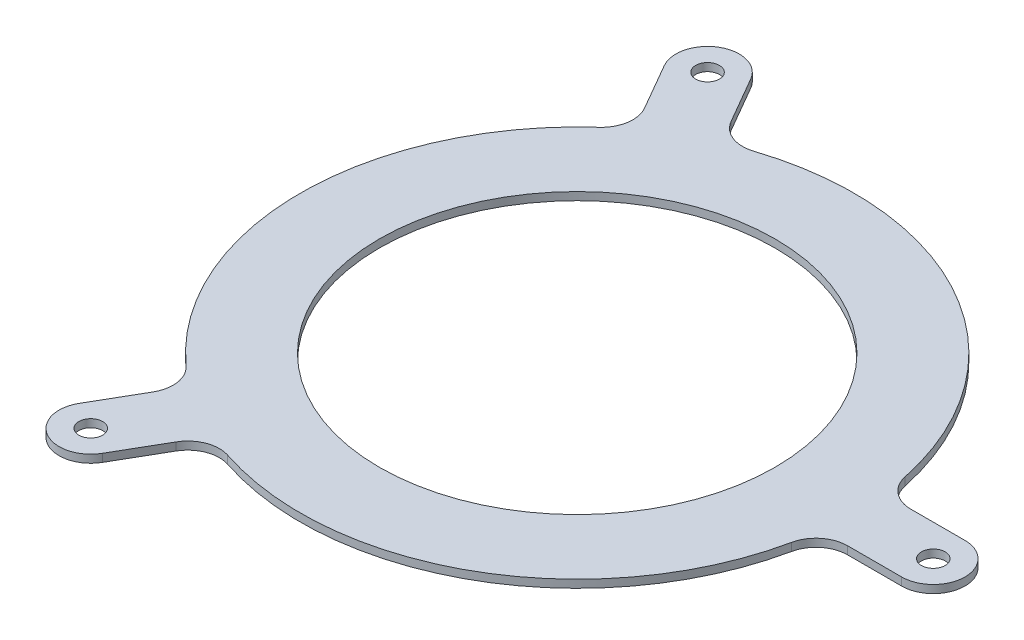
from build123d import *

# Parameters (mm, degrees)
SKETCH1_R           = 35
SKETCH1_R_2         = 25
SKETCH1_R_3         = 1.5
BOSS_EXTRUDE1_DEPTH = 1
FILLET1_R           = 4


with BuildPart() as part:
    # Sketch1 → Boss-Extrude1 (new body)
    # profile 1 of 4: a face of its own
    with BuildSketch(Plane(origin=(0, 0, 0), x_dir=(1, 0, 0), z_dir=(0, 1, 0))):
        Circle(SKETCH1_R)
        with Locations(Location((0, 0, 0), (0, 0, 270))):
            Circle(SKETCH1_R_2, mode=Mode.SUBTRACT)
    # profile 2 of 4: a face of its own
    with BuildSketch(Plane(origin=(0, 0, 0), x_dir=(1, 0, 0), z_dir=(0, 1, 0))):
        with BuildLine():
            ThreePointArc((-20.849440266, 28.11228985), (-17.5, 30.310889132), (-13.921237036, 32.11228985))
            Line((-13.921237036, 32.11228985), (-19.035586192, 40.970602437))
            Line((-19.035586192, 40.970602437), (-19.035898385, 40.97114317))
            ThreePointArc((-19.035898385, 40.97114317), (-24.5, 42.435244785), (-25.964101615, 36.97114317))
            Line((-25.964101615, 36.97114317), (-20.849440266, 28.11228985))
        make_face()
        with Locations(Location((-22.5, 38.97114317, 0), (0, 0, 270))):
            Circle(SKETCH1_R_3, mode=Mode.SUBTRACT)
    # profile 3 of 4: a face of its own
    with BuildSketch(Plane(origin=(0, 0, 0), x_dir=(1, 0, 0), z_dir=(0, 1, 0))):
        with BuildLine():
            Line((-19.035898385, -40.97114317), (-13.921237036, -32.11228985))
            ThreePointArc((-13.921237036, -32.11228985), (-17.5, -30.310889132), (-20.849440266, -28.11228985))
            Line((-20.849440266, -28.11228985), (-25.963789422, -36.970602437))
            Line((-25.963789422, -36.970602437), (-25.964101615, -36.97114317))
            ThreePointArc((-25.964101615, -36.97114317), (-24.5, -42.435244785), (-19.035898385, -40.97114317))
        make_face()
        with Locations(Location((-22.5, -38.97114317, 0), (0, 0, 270))):
            Circle(SKETCH1_R_3, mode=Mode.SUBTRACT)
    # profile 4 of 4: a face of its own
    with BuildSketch(Plane(origin=(0, 0, 0), x_dir=(1, 0, 0), z_dir=(0, 1, 0))):
        with BuildLine():
            ThreePointArc((45, -4), (49, 0), (45, 4))
            Line((45, 4), (34.770677301, 4))
            ThreePointArc((34.770677301, 4), (34.942622294, 2.00328411), (35, 0))
            ThreePointArc((35, 0), (34.942622294, -2.00328411), (34.770677301, -4))
            Line((34.770677301, -4), (44.999375615, -4))
            Line((44.999375615, -4), (45, -4))
        make_face()
        with Locations(Location((45, 0, 0), (0, 0, 270))):
            Circle(SKETCH1_R_3, mode=Mode.SUBTRACT)
    extrude(amount=BOSS_EXTRUDE1_DEPTH)

    # Fillet1
    fillet1_edges = [part.edges().sort_by_distance(p)[0] for p in [
        (-13.921237036, 0.5, 32.11228985),
        (-20.849440266, 0.5, 28.11228985),
        (-20.849440266, 0.5, -28.11228985),
        (-13.921237036, 0.5, -32.11228985),
        (34.770677301, 0.5, -4),
        (34.770677301, 0.5, 4),
    ]]
    fillet(fillet1_edges, radius=FILLET1_R)


solid = part.part
